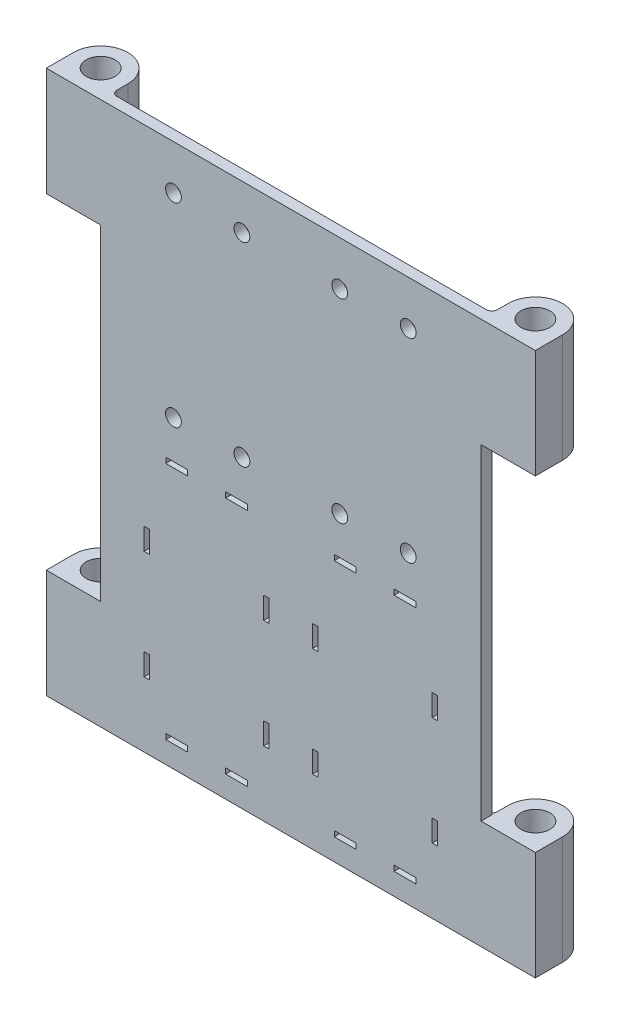
from build123d import *

# Parameters (mm, degrees)
BOSS_EXTRUDE1_DEPTH     = 63.5
SKETCH3_W               = 1.27
SKETCH3_H               = 5.08
CUT_EXTRUDE2_DEPTH      = 87.032540937
LPATTERN1_COUNT         = 2
LPATTERN1_PITCH         = 25.4
LPATTERN1_COUNT_DIR2    = 2
LPATTERN1_PITCH_DIR2    = 27.94
MIRROR1_COPY_1_SKETCH_W = 1.27
MIRROR1_COPY_1_SKETCH_H = 5.08
MIRROR1_COPY_1_DEPTH    = 87.032540937
MIRROR1_COPY_2_SKETCH_W = 1.27
MIRROR1_COPY_2_SKETCH_H = 5.08
MIRROR1_COPY_2_DEPTH    = 87.032540937
MIRROR1_COPY_3_SKETCH_W = 1.27
MIRROR1_COPY_3_SKETCH_H = 5.08
MIRROR1_COPY_3_DEPTH    = 87.032540937
SKETCH5_W               = 5.08
SKETCH5_H               = 1.27
CUT_EXTRUDE3_DEPTH      = 87.032540937
LPATTERN2_COUNT         = 2
LPATTERN2_PITCH         = 13.97
LPATTERN2_COUNT_DIR2    = 2
LPATTERN2_PITCH_DIR2    = 55.88
MIRROR2_COPY_1_SKETCH_W = 5.08
MIRROR2_COPY_1_SKETCH_H = 1.27
MIRROR2_COPY_1_DEPTH    = 87.032540937
MIRROR2_COPY_2_SKETCH_W = 5.08
MIRROR2_COPY_2_SKETCH_H = 1.27
MIRROR2_COPY_2_DEPTH    = 87.032540937
MIRROR2_COPY_3_SKETCH_W = 5.08
MIRROR2_COPY_3_SKETCH_H = 1.27
MIRROR2_COPY_3_DEPTH    = 87.032540937
F_1_0MM_DOWEL_HOLE1_D   = 3.7
LPATTERN3_COUNT         = 2
LPATTERN3_PITCH         = 16.002
LPATTERN3_COUNT_DIR2    = 2
LPATTERN3_PITCH_DIR2    = 45.466
MIRROR3_COPY_1_D        = 3.7
MIRROR3_COPY_2_D        = 3.7
MIRROR3_COPY_3_D        = 3.7
F_1_4_CLEARANCE_HOLE1_D = 6.7564
CUT_EXTRUDE4_DEPTH      = 38.1
FILLET1_R               = 1.27
FILLET2_R               = 1.27


with BuildPart() as part:
    # Sketch1 → Boss-Extrude1 (new, symmetric)
    with BuildSketch(Plane(origin=(0, 0, 0), x_dir=(1, 0, 0), z_dir=(0, 1, 0))):
        with BuildLine():
            Line((0, -6.35), (57.15, -6.35))
            Line((57.15, -6.35), (57.15, 0))
            ThreePointArc((57.15, 0), (50.799999392, 6.349999392), (44.45, -1.216e-06))
            Line((44.45, -1.216e-06), (44.45, -3.81))
            Line((44.45, -3.81), (-44.45, -3.81))
            Line((-44.45, -3.81), (-44.45, 0))
            ThreePointArc((-44.45, 0), (-50.8, 6.35), (-57.15, 0))
            Line((-57.15, 0), (-57.15, -6.35))
            Line((-57.15, -6.35), (0, -6.35))
        make_face()
    extrude(amount=BOSS_EXTRUDE1_DEPTH, both=True)

    # Sketch3 → Cut-Extrude2 (cut, through all)
    with BuildSketch(Plane(origin=(0, 0, 3.81), x_dir=(-1, 0, 0), z_dir=(0, 0, -1))):
        with Locations((5.715, -20.32)):
            Rectangle(SKETCH3_W, SKETCH3_H)
    cut_extrude2 = extrude(amount=-CUT_EXTRUDE2_DEPTH, mode=Mode.SUBTRACT)

    # LPattern1: Cut-Extrude2 2 × 2
    with Locations(*[(-j * LPATTERN1_PITCH_DIR2, -i * LPATTERN1_PITCH, 0) for i in range(LPATTERN1_COUNT) for j in range(LPATTERN1_COUNT_DIR2) if (i, j) != (0, 0)]):
        add(cut_extrude2, mode=Mode.SUBTRACT)

    # Mirror1: Cut-Extrude2 across plane
    add(cut_extrude2.mirror(Plane(origin=(0, 0, 0), x_dir=(0, 0, 1), z_dir=(1, 0, 0))), mode=Mode.SUBTRACT)

    # Mirror1 copy 1 sketch → Mirror1 copy 1 (cut, through all)
    with BuildSketch(Plane(origin=(27.94, 0, 3.81), x_dir=(1, 0, 0), z_dir=(0, 0, -1))):
        with Locations((5.715, 20.32)):
            Rectangle(MIRROR1_COPY_1_SKETCH_W, MIRROR1_COPY_1_SKETCH_H)
    extrude(amount=-MIRROR1_COPY_1_DEPTH, mode=Mode.SUBTRACT)

    # Mirror1 copy 2 sketch → Mirror1 copy 2 (cut, through all)
    with BuildSketch(Plane(origin=(0, -25.4, 3.81), x_dir=(1, 0, 0), z_dir=(0, 0, -1))):
        with Locations((5.715, 20.32)):
            Rectangle(MIRROR1_COPY_2_SKETCH_W, MIRROR1_COPY_2_SKETCH_H)
    extrude(amount=-MIRROR1_COPY_2_DEPTH, mode=Mode.SUBTRACT)

    # Mirror1 copy 3 sketch → Mirror1 copy 3 (cut, through all)
    with BuildSketch(Plane(origin=(27.94, -25.4, 3.81), x_dir=(1, 0, 0), z_dir=(0, 0, -1))):
        with Locations((5.715, 20.32)):
            Rectangle(MIRROR1_COPY_3_SKETCH_W, MIRROR1_COPY_3_SKETCH_H)
    extrude(amount=-MIRROR1_COPY_3_DEPTH, mode=Mode.SUBTRACT)

    # Sketch5 → Cut-Extrude3 (cut, through all)
    with BuildSketch(Plane(origin=(0, 0, 3.81), x_dir=(-1, 0, 0), z_dir=(0, 0, -1))):
        with Locations((12.7, -1.905)):
            Rectangle(SKETCH5_W, SKETCH5_H)
    cut_extrude3 = extrude(amount=-CUT_EXTRUDE3_DEPTH, mode=Mode.SUBTRACT)

    # LPattern2: Cut-Extrude3 2 × 2
    with Locations(*[(-i * LPATTERN2_PITCH, -j * LPATTERN2_PITCH_DIR2, 0) for i in range(LPATTERN2_COUNT) for j in range(LPATTERN2_COUNT_DIR2) if (i, j) != (0, 0)]):
        add(cut_extrude3, mode=Mode.SUBTRACT)

    # Mirror2: Cut-Extrude3 across plane
    add(cut_extrude3.mirror(Plane(origin=(0, 0, 0), x_dir=(0, 0, 1), z_dir=(1, 0, 0))), mode=Mode.SUBTRACT)

    # Mirror2 copy 1 sketch → Mirror2 copy 1 (cut, through all)
    with BuildSketch(Plane(origin=(0, -55.88, 3.81), x_dir=(1, 0, 0), z_dir=(0, 0, -1))):
        with Locations((12.7, 1.905)):
            Rectangle(MIRROR2_COPY_1_SKETCH_W, MIRROR2_COPY_1_SKETCH_H)
    extrude(amount=-MIRROR2_COPY_1_DEPTH, mode=Mode.SUBTRACT)

    # Mirror2 copy 2 sketch → Mirror2 copy 2 (cut, through all)
    with BuildSketch(Plane(origin=(13.97, 0, 3.81), x_dir=(1, 0, 0), z_dir=(0, 0, -1))):
        with Locations((12.7, 1.905)):
            Rectangle(MIRROR2_COPY_2_SKETCH_W, MIRROR2_COPY_2_SKETCH_H)
    extrude(amount=-MIRROR2_COPY_2_DEPTH, mode=Mode.SUBTRACT)

    # Mirror2 copy 3 sketch → Mirror2 copy 3 (cut, through all)
    with BuildSketch(Plane(origin=(13.97, -55.88, 3.81), x_dir=(1, 0, 0), z_dir=(0, 0, -1))):
        with Locations((12.7, 1.905)):
            Rectangle(MIRROR2_COPY_3_SKETCH_W, MIRROR2_COPY_3_SKETCH_H)
    extrude(amount=-MIRROR2_COPY_3_DEPTH, mode=Mode.SUBTRACT)

    # Ø1.0mm Dowel Hole1 (through all)
    with Locations(Plane(origin=(0, 0, 0), x_dir=(1, 0, 0), z_dir=(0, 0, -1))):
        with Locations((-11.43, -7.62)):
            f_1_0mm_dowel_hole1 = Hole(F_1_0MM_DOWEL_HOLE1_D / 2)

    # LPattern3: 1.0mm Dowel Hole1 2 × 2
    with Locations(*[(-i * LPATTERN3_PITCH, j * LPATTERN3_PITCH_DIR2, 0) for i in range(LPATTERN3_COUNT) for j in range(LPATTERN3_COUNT_DIR2) if (i, j) != (0, 0)]):
        add(f_1_0mm_dowel_hole1, mode=Mode.SUBTRACT)

    # Mirror3: Ø1.0mm Dowel Hole1 across plane
    add(f_1_0mm_dowel_hole1.mirror(Plane(origin=(0, 0, 0), x_dir=(0, 0, 1), z_dir=(1, 0, 0))), mode=Mode.SUBTRACT)

    # Mirror3 copy 1 (through all)
    with Locations(Plane(origin=(0, 45.466, 0), x_dir=(-1, 0, 0), z_dir=(0, 0, -1))):
        with Locations((-11.43, 7.62)):
            Hole(MIRROR3_COPY_1_D / 2)

    # Mirror3 copy 2 (through all)
    with Locations(Plane(origin=(16.002, 0, 0), x_dir=(-1, 0, 0), z_dir=(0, 0, -1))):
        with Locations((-11.43, 7.62)):
            Hole(MIRROR3_COPY_2_D / 2)

    # Mirror3 copy 3 (through all)
    with Locations(Plane(origin=(16.002, 45.466, 0), x_dir=(-1, 0, 0), z_dir=(0, 0, -1))):
        with Locations((-11.43, 7.62)):
            Hole(MIRROR3_COPY_3_D / 2)

    # 1/4 Clearance Hole1 (through all)
    with Locations(Plane(origin=(0, 63.5, 0), x_dir=(1, 0, 0), z_dir=(0, 1, 0))):
        with Locations((-50.8, 0)):
            f_1_4_clearance_hole1 = Hole(F_1_4_CLEARANCE_HOLE1_D / 2)

    # Mirror4: 1/4 Clearance Hole1 across plane
    add(f_1_4_clearance_hole1.mirror(Plane(origin=(0, 0, 0), x_dir=(0, 0, 1), z_dir=(1, 0, 0))), mode=Mode.SUBTRACT)

    # Sketch16 → Cut-Extrude4 (cut, symmetric)
    with BuildSketch(Plane(origin=(0, 0, 0), x_dir=(1, 0, 0), z_dir=(0, 1, 0))):
        with BuildLine():
            Line((-57.15, 0), (-57.15, -6.35))
            Line((-57.15, -6.35), (-44.45, -6.35))
            Line((-44.45, -6.35), (-44.45, 0))
            ThreePointArc((-44.45, 0), (-50.8, 6.35), (-57.15, 0))
        make_face()
    cut_extrude4 = extrude(amount=CUT_EXTRUDE4_DEPTH, both=True, mode=Mode.SUBTRACT)

    # Mirror5: Cut-Extrude4 across plane
    add(cut_extrude4.mirror(Plane(origin=(0, 0, 0), x_dir=(0, 0, 1), z_dir=(1, 0, 0))), mode=Mode.SUBTRACT)

    # Fillet1
    fillet1_edges = [part.edges().sort_by_distance(p)[0] for p in [
        (-44.45, 50.8, 3.81),
        (-44.45, -50.8, 3.81),
    ]]
    fillet(fillet1_edges, radius=FILLET1_R)

    # Fillet2
    fillet2_edges = [part.edges().sort_by_distance(p)[0] for p in [
        (44.45, 50.8, 3.81),
        (44.45, -50.8, 3.81),
    ]]
    fillet(fillet2_edges, radius=FILLET2_R)


solid = part.part
